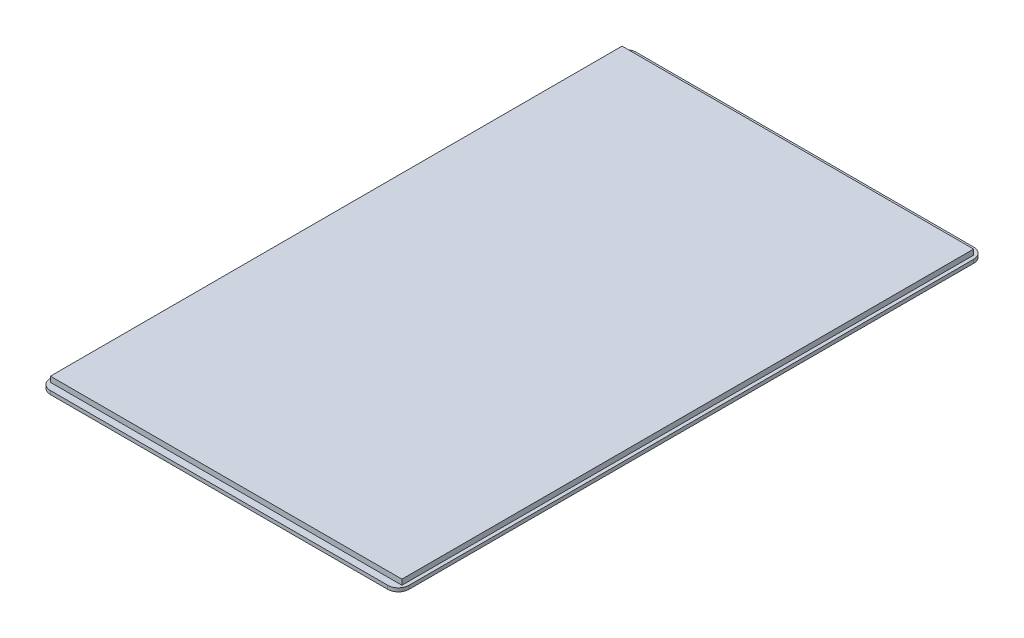
from build123d import *

# Parameters (mm, degrees)
SKETCH1_W           = 101
SKETCH1_H           = 165
BOSS_EXTRUDE1_DEPTH = 1
SKETCH2_W           = 99
SKETCH2_H           = 161
BOSS_EXTRUDE2_DEPTH = 1.5
FILLET1_R           = 3


with BuildPart() as part:
    # Sketch1 → Boss-Extrude1 (new body)
    with BuildSketch(Plane(origin=(0, 0, 0), x_dir=(1, 0, 0), z_dir=(0, 1, 0))):
        Rectangle(SKETCH1_W, SKETCH1_H)
    extrude(amount=BOSS_EXTRUDE1_DEPTH)

    # Sketch2 → Boss-Extrude2 (add)
    with BuildSketch(Plane(origin=(0, 1, 0), x_dir=(1, 0, 0), z_dir=(0, 1, 0))):
        Rectangle(SKETCH2_W, SKETCH2_H)
    extrude(amount=BOSS_EXTRUDE2_DEPTH)

    # Fillet1
    fillet1_edges = [part.edges().sort_by_distance(p)[0] for p in [
        (50.5, 0.5, 82.5),
        (-50.5, 0.5, 82.5),
        (-50.5, 0.5, -82.5),
        (50.5, 0.5, -82.5),
    ]]
    fillet(fillet1_edges, radius=FILLET1_R)


solid = part.part
